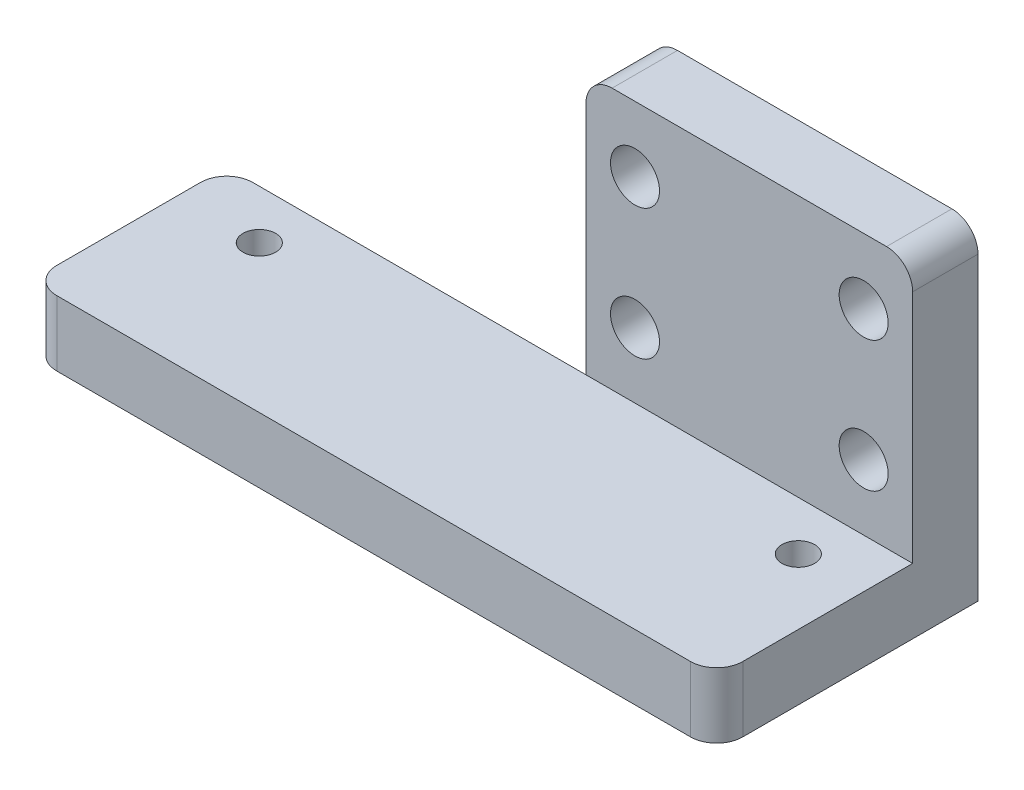
from build123d import *

# Parameters (mm, degrees)
SKETCH1_W           = 31.75
SKETCH1_H           = 31.75
SKETCH1_R           = 2.38125
BOSS_EXTRUDE1_DEPTH = 6.35
SKETCH2_W           = 66.675
SKETCH2_H           = 6.35
BOSS_EXTRUDE2_DEPTH = 19.05
SKETCH3_R           = 1.5875
CUT_EXTRUDE1_DEPTH  = 63.217039467
FILLET1_R           = 2.54


with BuildPart() as part:
    # Sketch1 → Boss-Extrude1 (new body)
    with BuildSketch(Plane.XY):
        Rectangle(SKETCH1_W, SKETCH1_H)
        with Locations((-11.1125, -3.175)):
            Circle(SKETCH1_R, mode=Mode.SUBTRACT)
        with Locations((-11.1125, 9.525)):
            Circle(SKETCH1_R, mode=Mode.SUBTRACT)
        with Locations((11.1125, 9.525)):
            Circle(SKETCH1_R, mode=Mode.SUBTRACT)
        with Locations((11.1125, -3.175)):
            Circle(SKETCH1_R, mode=Mode.SUBTRACT)
    extrude(amount=BOSS_EXTRUDE1_DEPTH)

    # Sketch2 → Boss-Extrude2 (add)
    with BuildSketch(Plane.XY.offset(6.35)):
        with Locations((-17.4625, -12.7)):
            Rectangle(SKETCH2_W, SKETCH2_H)
    extrude(amount=BOSS_EXTRUDE2_DEPTH)

    # Sketch3 → Cut-Extrude1 (cut, through all)
    with BuildSketch(Plane(origin=(0, -9.525, 0), x_dir=(1, 0, 0), z_dir=(0, 1, 0))):
        with Locations(Location((9.525, -11.1125, 0), (0, 0, 270))):
            Circle(SKETCH3_R)
        with Locations(Location((-42.8625, -11.1125, 0), (0, 0, 270))):
            Circle(SKETCH3_R)
    extrude(amount=-CUT_EXTRUDE1_DEPTH, mode=Mode.SUBTRACT)

    # Fillet1
    fillet1_edges = [part.edges().sort_by_distance(p)[0] for p in [
        (-50.8, -12.7, 6.35),
        (-50.8, -12.7, 25.4),
        (15.875, -12.7, 25.4),
        (-15.875, 15.875, 3.175),
        (15.875, 15.875, 3.175),
    ]]
    fillet(fillet1_edges, radius=FILLET1_R)


solid = part.part
